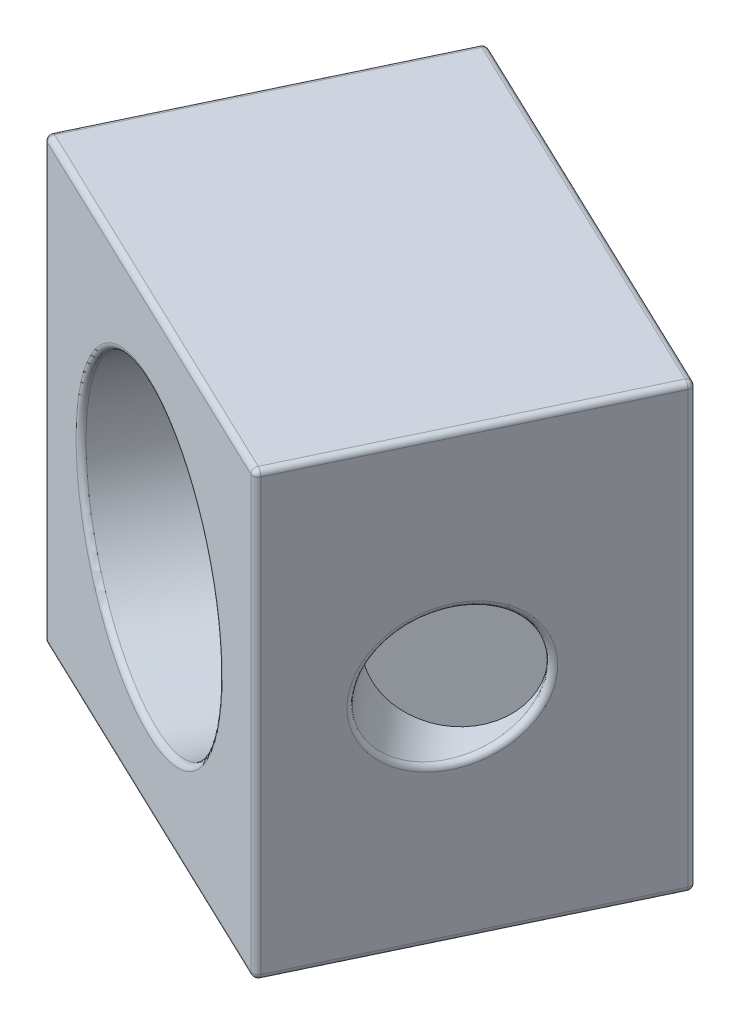
from build123d import *

# Parameters (mm, degrees)
BOSS_EXTRUDE1_DEPTH      = 20
BOSS_EXTRUDE1_DEPTH_BACK = 20
CUT_SWEEP1_PROFILE_R     = 13.5
CUT_SWEEP2_PROFILE_R     = 6
FILLET1_R                = 0.5


with BuildPart() as part:
    # Sketch19 → Boss-Extrude1 (new, two sides: drawn at the far end of the back side and taken through both)
    with BuildSketch(Plane(origin=(0, 0, 0), x_dir=(1, 0, 0), z_dir=(0, 1, 0)).offset(-BOSS_EXTRUDE1_DEPTH_BACK)):
        Polygon((134.915401848, 322.806168715), (138.300353153, 321.192289952), (125.389323054, 294.112679509), (122.004371748, 295.726558271), (89.283175796, 311.327386308), (102.194205895, 338.406996751), align=None)
    extrude(amount=BOSS_EXTRUDE1_DEPTH + BOSS_EXTRUDE1_DEPTH_BACK)

    # Cut-Sweep1: sweep along a path in Sketch5
    with BuildLine(Plane(origin=(0, 0, 0), x_dir=(1, 0, 0), z_dir=(0, 1, 0))) as cut_sweep1_path:
        Line((15.451096543, 110), (223.369661717, 546.088654867))
    # Cut-Sweep1 profile (on start of the path) → Cut-Sweep1 (sweep, cut)
    with BuildSketch(Plane(origin=(15.451096543, 0, -110), x_dir=(-0.9026536814530927, 0, -0.43036766997438236), z_dir=(0.43036766997438236, 0, -0.9026536814530927))):
        Circle(CUT_SWEEP1_PROFILE_R)
    sweep(path=cut_sweep1_path.line, mode=Mode.SUBTRACT)

    # Cut-Sweep2: sweep along a path in Sketch33
    with BuildLine(Plane(origin=(0, 0, 0), x_dir=(1, 0, 0), z_dir=(0, 1, 0))) as cut_sweep2_path:
        Line((128.459886798, 309.266363493), (271.805005174, 137.491575647))
    # Cut-Sweep2 profile (on start of the path) → Cut-Sweep2 (sweep, cut)
    with BuildSketch(Plane(origin=(128.459886798, 0, -309.266363493), x_dir=(0.767782639292157, 0, -0.6407104016648784), z_dir=(0.6407104016648784, 0, 0.767782639292157))):
        Circle(CUT_SWEEP2_PROFILE_R)
    sweep(path=cut_sweep2_path.line, mode=Mode.SUBTRACT)

    # Fillet1
    fillet1_edges = [part.edges().sort_by_distance(p)[0] for p in [
        (132.433104224, 0, -323.989679807),
        (120.247279524, -20, -329.799643352),
        (107.336249425, -20, -302.720032908),
        (119.522074124, 0, -296.910069363),
        (131.844838103, -20, -307.65248473),
        (125.389323054, 0, -294.112679509),
        (138.300353153, 0, -321.192289952),
        (128.262320501, -7.134e-05, -300.138507895),
        (131.844838103, 20, -307.65248473),
        (107.336249425, 20, -302.720032908),
        (120.247279524, 20, -329.799643352),
        (95.738690845, -20, -324.867191529),
        (102.194205895, 0, -338.406996751),
        (95.738690845, 20, -324.867191529),
        (89.283175796, 0, -311.327386308),
    ]]
    fillet(fillet1_edges, radius=FILLET1_R)


solid = part.part
